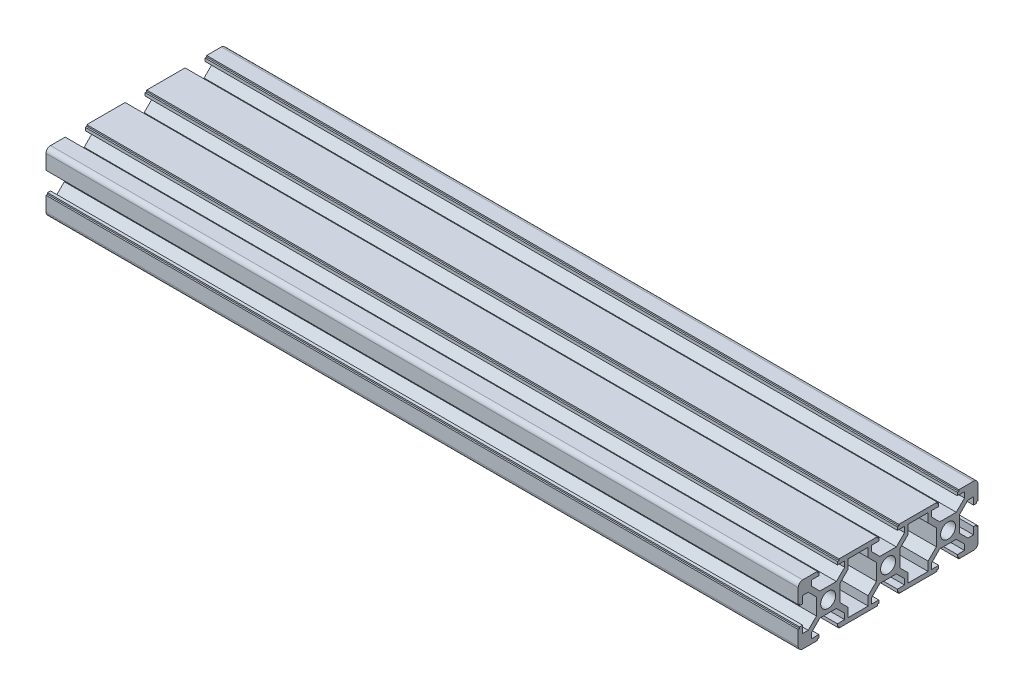
from build123d import *

# Parameters (mm, degrees)
SKETCH1_R                = 2.5
F_20_X_20_X_R1_5_1_DEPTH = 251


with BuildPart() as part:
    # Sketch1 → 铝型材 20 X 20 X R1.5(1) (new body)
    with BuildSketch(Plane(origin=(548.637296324, 8.985389246, 0), x_dir=(0, 1, 0), z_dir=(1, 0, 0))):
        with BuildLine():
            Line((-10, -3.6), (-9.5, -3.6))
            Line((-9.5, -3.6), (-9.5, -3.1))
            Line((-9.5, -3.1), (-8.5, -3.1))
            Line((-8.5, -3.1), (-8.5, -5.5))
            Line((-8.5, -5.5), (-6.65, -5.5))
            Line((-6.65, -5.5), (-3.9, -2.75))
            Line((-3.9, -2.75), (-3.9, 2.75))
            Line((-3.9, 2.75), (-6.65, 5.5))
            Line((-6.65, 5.5), (-8.5, 5.5))
            Line((-8.5, 5.5), (-8.5, 3.1))
            Line((-8.5, 3.1), (-9.5, 3.1))
            Line((-9.5, 3.1), (-9.5, 3.6))
            Line((-9.5, 3.6), (-10, 3.6))
            Line((-10, 3.6), (-10, 8.5))
            Line((-10, 8.5), (-10, 11.5))
            Line((-10, 11.5), (-10, 16.4))
            Line((-10, 16.4), (-9.5, 16.4))
            Line((-9.5, 16.4), (-9.5, 16.9))
            Line((-9.5, 16.9), (-8.5, 16.9))
            Line((-8.5, 16.9), (-8.5, 14.5))
            Line((-8.5, 14.5), (-6.65, 14.5))
            Line((-6.65, 14.5), (-3.9, 17.25))
            Line((-3.9, 17.25), (-3.9, 22.75))
            Line((-3.9, 22.75), (-6.65, 25.5))
            Line((-6.65, 25.5), (-8.5, 25.5))
            Line((-8.5, 25.5), (-8.5, 23.1))
            Line((-8.5, 23.1), (-9.5, 23.1))
            Line((-9.5, 23.1), (-9.5, 23.6))
            Line((-9.5, 23.6), (-10, 23.6))
            Line((-10, 23.6), (-10, 28.5))
            Line((-10, 28.5), (-10, 31.5))
            Line((-10, 31.5), (-10, 36.4))
            Line((-10, 36.4), (-9.5, 36.4))
            Line((-9.5, 36.4), (-9.5, 36.9))
            Line((-9.5, 36.9), (-8.5, 36.9))
            Line((-8.5, 36.9), (-8.5, 34.5))
            Line((-8.5, 34.5), (-6.65, 34.5))
            Line((-6.65, 34.5), (-3.9, 37.25))
            Line((-3.9, 37.25), (-3.9, 42.75))
            Line((-3.9, 42.75), (-6.65, 45.5))
            Line((-6.65, 45.5), (-8.5, 45.5))
            Line((-8.5, 45.5), (-8.5, 43.1))
            Line((-8.5, 43.1), (-9.5, 43.1))
            Line((-9.5, 43.1), (-9.5, 43.6))
            Line((-9.5, 43.6), (-10, 43.6))
            Line((-10, 43.6), (-10, 48.5))
            ThreePointArc((-10, 48.5), (-9.560660172, 49.560660172), (-8.5, 50))
            Line((-8.5, 50), (-3.6, 50))
            Line((-3.6, 50), (-3.6, 49.5))
            Line((-3.6, 49.5), (-3.1, 49.5))
            Line((-3.1, 49.5), (-3.1, 48.5))
            Line((-3.1, 48.5), (-5.5, 48.5))
            Line((-5.5, 48.5), (-5.5, 46.65))
            Line((-5.5, 46.65), (-2.75, 43.9))
            Line((-2.75, 43.9), (2.75, 43.9))
            Line((2.75, 43.9), (5.5, 46.65))
            Line((5.5, 46.65), (5.5, 48.5))
            Line((5.5, 48.5), (3.1, 48.5))
            Line((3.1, 48.5), (3.1, 49.5))
            Line((3.1, 49.5), (3.6, 49.5))
            Line((3.6, 49.5), (3.6, 50))
            Line((3.6, 50), (8.5, 50))
            ThreePointArc((8.5, 50), (9.560660172, 49.560660172), (10, 48.5))
            Line((10, 48.5), (10, 43.6))
            Line((10, 43.6), (9.5, 43.6))
            Line((9.5, 43.6), (9.5, 43.1))
            Line((9.5, 43.1), (8.5, 43.1))
            Line((8.5, 43.1), (8.5, 45.5))
            Line((8.5, 45.5), (6.65, 45.5))
            Line((6.65, 45.5), (3.9, 42.75))
            Line((3.9, 42.75), (3.9, 37.25))
            Line((3.9, 37.25), (6.65, 34.5))
            Line((6.65, 34.5), (8.5, 34.5))
            Line((8.5, 34.5), (8.5, 36.9))
            Line((8.5, 36.9), (9.5, 36.9))
            Line((9.5, 36.9), (9.5, 36.4))
            Line((9.5, 36.4), (10, 36.4))
            Line((10, 36.4), (10, 31.5))
            Line((10, 31.5), (10, 28.5))
            Line((10, 28.5), (10, 23.6))
            Line((10, 23.6), (9.5, 23.6))
            Line((9.5, 23.6), (9.5, 23.1))
            Line((9.5, 23.1), (8.5, 23.1))
            Line((8.5, 23.1), (8.5, 25.5))
            Line((8.5, 25.5), (6.65, 25.5))
            Line((6.65, 25.5), (3.9, 22.75))
            Line((3.9, 22.75), (3.9, 17.25))
            Line((3.9, 17.25), (6.65, 14.5))
            Line((6.65, 14.5), (8.5, 14.5))
            Line((8.5, 14.5), (8.5, 16.9))
            Line((8.5, 16.9), (9.5, 16.9))
            Line((9.5, 16.9), (9.5, 16.4))
            Line((9.5, 16.4), (10, 16.4))
            Line((10, 16.4), (10, 11.5))
            Line((10, 11.5), (10, 8.5))
            Line((10, 8.5), (10, 3.6))
            Line((10, 3.6), (9.5, 3.6))
            Line((9.5, 3.6), (9.5, 3.1))
            Line((9.5, 3.1), (8.5, 3.1))
            Line((8.5, 3.1), (8.5, 5.5))
            Line((8.5, 5.5), (6.65, 5.5))
            Line((6.65, 5.5), (3.9, 2.75))
            Line((3.9, 2.75), (3.9, -2.75))
            Line((3.9, -2.75), (6.65, -5.5))
            Line((6.65, -5.5), (8.5, -5.5))
            Line((8.5, -5.5), (8.5, -3.1))
            Line((8.5, -3.1), (9.5, -3.1))
            Line((9.5, -3.1), (9.5, -3.6))
            Line((9.5, -3.6), (10, -3.6))
            Line((10, -3.6), (10, -8.5))
            ThreePointArc((10, -8.5), (9.560660172, -9.560660172), (8.5, -10))
            Line((8.5, -10), (3.6, -10))
            Line((3.6, -10), (3.6, -9.5))
            Line((3.6, -9.5), (3.1, -9.5))
            Line((3.1, -9.5), (3.1, -8.5))
            Line((3.1, -8.5), (5.5, -8.5))
            Line((5.5, -8.5), (5.5, -6.65))
            Line((5.5, -6.65), (2.75, -3.9))
            Line((2.75, -3.9), (-2.75, -3.9))
            Line((-2.75, -3.9), (-5.5, -6.65))
            Line((-5.5, -6.65), (-5.5, -8.5))
            Line((-5.5, -8.5), (-3.1, -8.5))
            Line((-3.1, -8.5), (-3.1, -9.5))
            Line((-3.1, -9.5), (-3.6, -9.5))
            Line((-3.6, -9.5), (-3.6, -10))
            Line((-3.6, -10), (-8.5, -10))
            ThreePointArc((-8.5, -10), (-9.560660172, -9.560660172), (-10, -8.5))
            Line((-10, -8.5), (-10, -3.6))
        make_face()
        Circle(SKETCH1_R, mode=Mode.SUBTRACT)
        with Locations((0, 20)):
            Circle(SKETCH1_R, mode=Mode.SUBTRACT)
        with Locations((0, 40)):
            Circle(SKETCH1_R, mode=Mode.SUBTRACT)
        Polygon((-5.5, 6.65), (-8.5, 6.65), (-8.5, 13.35), (-5.5, 13.35), (-2.75, 16.1), (2.75, 16.1), (5.5, 13.35), (8.5, 13.35), (8.5, 6.65), (5.5, 6.65), (2.75, 3.9), (-2.75, 3.9), align=None, mode=Mode.SUBTRACT)
        Polygon((-5.5, 26.65), (-8.5, 26.65), (-8.5, 33.35), (-5.5, 33.35), (-2.75, 36.1), (2.75, 36.1), (5.5, 33.35), (8.5, 33.35), (8.5, 26.65), (5.5, 26.65), (2.75, 23.9), (-2.75, 23.9), align=None, mode=Mode.SUBTRACT)
    extrude(amount=F_20_X_20_X_R1_5_1_DEPTH)


solid = part.part
